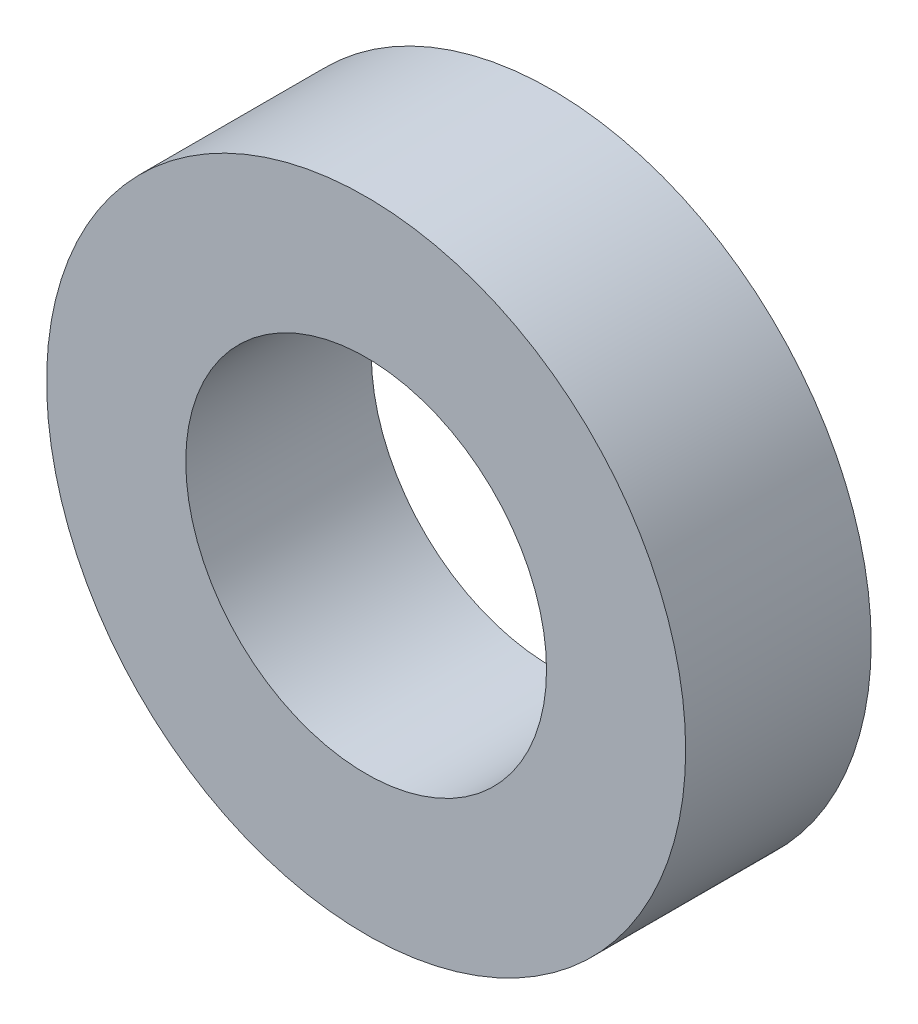
from build123d import *

# Parameters (mm, degrees)
SKETCH_1_R      = 31
SKETCH_1_R_2    = 17.5
EXTRUDE_1_DEPTH = 18


with BuildPart() as part:
    # 草图1 → 凸台-拉伸1 (new body)
    with BuildSketch(Plane.XY):
        Circle(SKETCH_1_R)
        Circle(SKETCH_1_R_2, mode=Mode.SUBTRACT)
    extrude(amount=EXTRUDE_1_DEPTH)


solid = part.part
